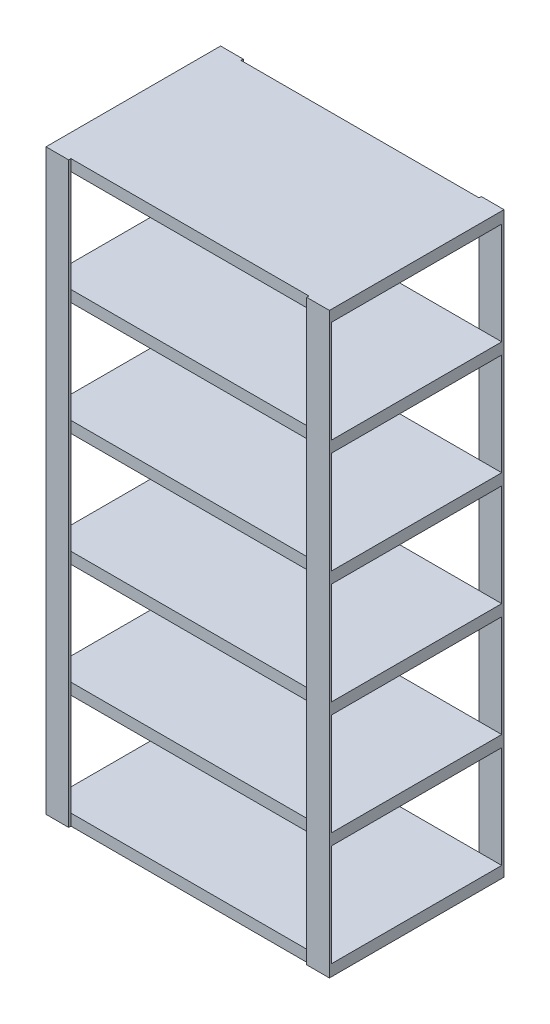
from build123d import *

# Parameters (mm, degrees)
SKIZZE1_W                       = 250
SKIZZE1_H                       = 150
AUFSATZ_LINEAR_AUSTRAGEN1_DEPTH = 5
SKIZZE2_W                       = 20
SKIZZE2_H                       = 510
AUFSATZ_LINEAR_AUSTRAGEN2_DEPTH = 2
SKIZZE3_W                       = 20
SKIZZE3_H                       = 510
AUFSATZ_LINEAR_AUSTRAGEN3_DEPTH = 2
LINEARES_MUSTER3_COUNT          = 6
LINEARES_MUSTER3_PITCH          = 100


with BuildPart() as part:
    # Skizze1 → Aufsatz-Linear austragen1 (new, symmetric)
    with BuildSketch(Plane(origin=(0, 0, 0), x_dir=(1, 0, 0), z_dir=(0, 1, 0))):
        Rectangle(SKIZZE1_W, SKIZZE1_H)
    aufsatz_linear_austragen1 = extrude(amount=AUFSATZ_LINEAR_AUSTRAGEN1_DEPTH, both=True)

    # Skizze2 → Aufsatz-Linear austragen2 (add)
    with BuildSketch(Plane.XY.offset(75)):
        with Locations((-115, 250)):
            Rectangle(SKIZZE2_W, SKIZZE2_H)
        with Locations((115, 250)):
            Rectangle(SKIZZE2_W, SKIZZE2_H)
    extrude(amount=AUFSATZ_LINEAR_AUSTRAGEN2_DEPTH)

    # Skizze3 → Aufsatz-Linear austragen3 (add)
    with BuildSketch(Plane(origin=(0, 0, -75), x_dir=(-1, 0, 0), z_dir=(0, 0, -1))):
        with Locations((-115, 250)):
            Rectangle(SKIZZE3_W, SKIZZE3_H)
        with Locations((115, 250)):
            Rectangle(SKIZZE3_W, SKIZZE3_H)
    extrude(amount=AUFSATZ_LINEAR_AUSTRAGEN3_DEPTH)

    # Lineares Muster3: Aufsatz-Linear austragen1 ×6
    with Locations(*[(0, i * LINEARES_MUSTER3_PITCH, 0) for i in range(1, LINEARES_MUSTER3_COUNT)]):
        add(aufsatz_linear_austragen1)


solid = part.part
